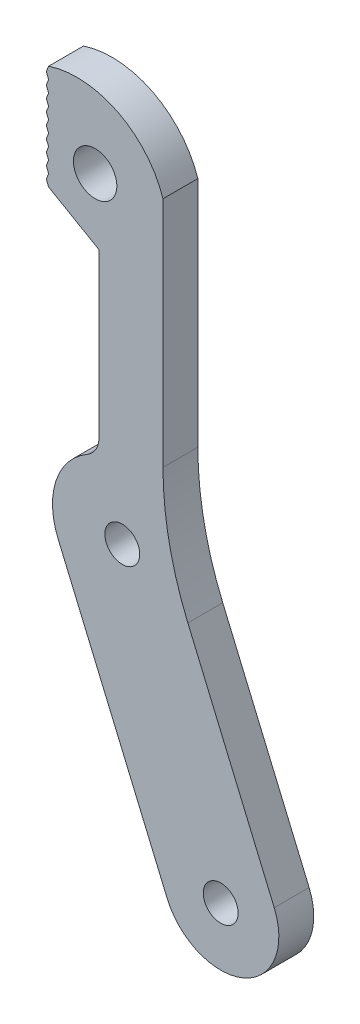
from build123d import *

# Parameters (mm, degrees)
SKETCH1_R           = 1.5
SKETCH1_R_2         = 1.866773139
BOSS_EXTRUDE2_DEPTH = 3


with BuildPart() as part:
    # Sketch1 → Boss-Extrude2 (new body)
    with BuildSketch(Plane.XY):
        with BuildLine():
            Line((19.955328479, -21.686654411), (19.955328479, -7.686654411))
            Line((19.955328479, -7.686654411), (15.62520146, -5.186654411))
            Line((15.62520146, -5.186654411), (15.42520146, -4.686654411))
            Line((15.42520146, -4.686654411), (15.62520146, -4.186654411))
            Line((15.62520146, -4.186654411), (15.42520146, -3.686654411))
            Line((15.42520146, -3.686654411), (15.62520146, -3.186654411))
            Line((15.62520146, -3.186654411), (15.42520146, -2.686654411))
            Line((15.42520146, -2.686654411), (15.62520146, -2.186654411))
            Line((15.62520146, -2.186654411), (15.42520146, -1.686654411))
            Line((15.42520146, -1.686654411), (15.62520146, -1.186654411))
            Line((15.62520146, -1.186654411), (15.42520146, -0.686654411))
            Line((15.42520146, -0.686654411), (15.62520146, -0.186654411))
            Line((15.62520146, -0.186654411), (15.42520146, 0.313345589))
            Line((15.42520146, 0.313345589), (15.62520146, 0.813345589))
            Line((15.62520146, 0.813345589), (15.42520146, 1.313345589))
            Line((15.42520146, 1.313345589), (15.62520146, 1.813345589))
            Line((15.62520146, 1.813345589), (15.42520146, 2.313345589))
            Line((15.42520146, 2.313345589), (15.62520146, 2.813345589))
            Line((15.62520146, 2.813345589), (15.42520146, 3.313345589))
            Line((15.42520146, 3.313345589), (15.62520146, 3.813345589))
            ThreePointArc((15.62520146, 3.813345589), (21.566278502, 3.372215768), (25.455328479, -1.140685983))
            Line((25.455328479, -1.140685983), (25.455328479, -21.140685983))
            ThreePointArc((25.455328479, -21.140685983), (25.995551768, -26.504062064), (27.594518651, -31.651969317))
            Line((27.594518651, -31.651969317), (35.020472422, -49.140685983))
            ThreePointArc((35.020472422, -49.140685983), (32.372376923, -55.697178203), (25.815884703, -53.049082704))
            Line((25.815884703, -53.049082704), (16.435732572, -30.958072179))
            ThreePointArc((16.435732572, -30.958072179), (16.267997475, -26.710838203), (18.95611766, -23.418249345))
            ThreePointArc((18.95611766, -23.418249345), (19.687607088, -22.686259743), (19.955328479, -21.686654411))
        make_face()
        with Locations((30.418178563, -51.094884343)):
            Circle(SKETCH1_R, mode=Mode.SUBTRACT)
        with Locations((19.62520146, -2.186654411)):
            Circle(SKETCH1_R_2, mode=Mode.SUBTRACT)
        with Locations((21.958485203, -28.613034147)):
            Circle(SKETCH1_R, mode=Mode.SUBTRACT)
    extrude(amount=BOSS_EXTRUDE2_DEPTH)


solid = part.part
